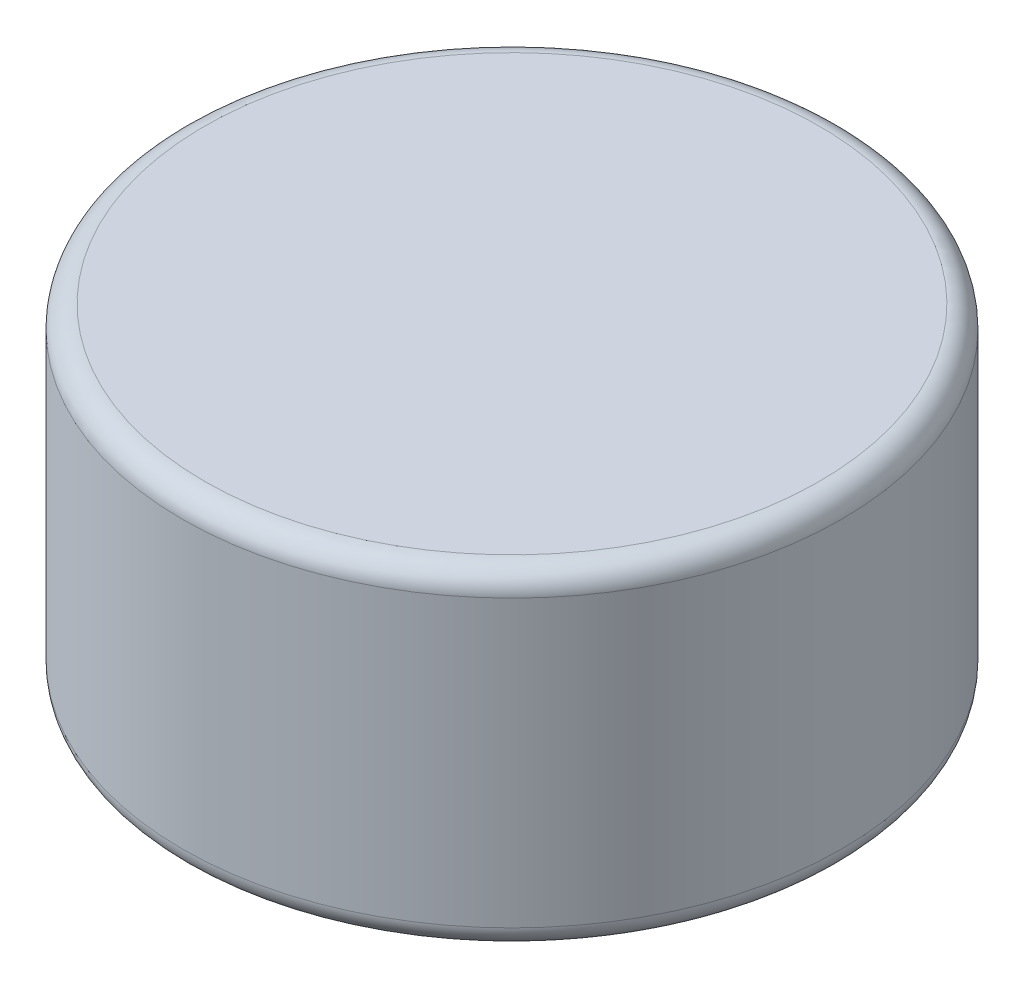
from build123d import *

# Parameters (mm, degrees)
SKETCH_1_R      = 3
EXTRUDE_1_DEPTH = 3
FILLET_1_R      = 0.2


with BuildPart() as part:
    # 草图1 → 凸台-拉伸1 (new body)
    with BuildSketch(Plane(origin=(0, 0, 0), x_dir=(1, 0, 0), z_dir=(0, 1, 0))):
        with Locations(Location((0, 0, 0), (0, 0, 270))):
            Circle(SKETCH_1_R)
    extrude(amount=EXTRUDE_1_DEPTH)

    # 圆角1
    fillet_1_edges = [part.edges().sort_by_distance(p)[0] for p in [
        (0, 0, -3),
        (0, 3, -3),
    ]]
    fillet(fillet_1_edges, radius=FILLET_1_R)


solid = part.part
